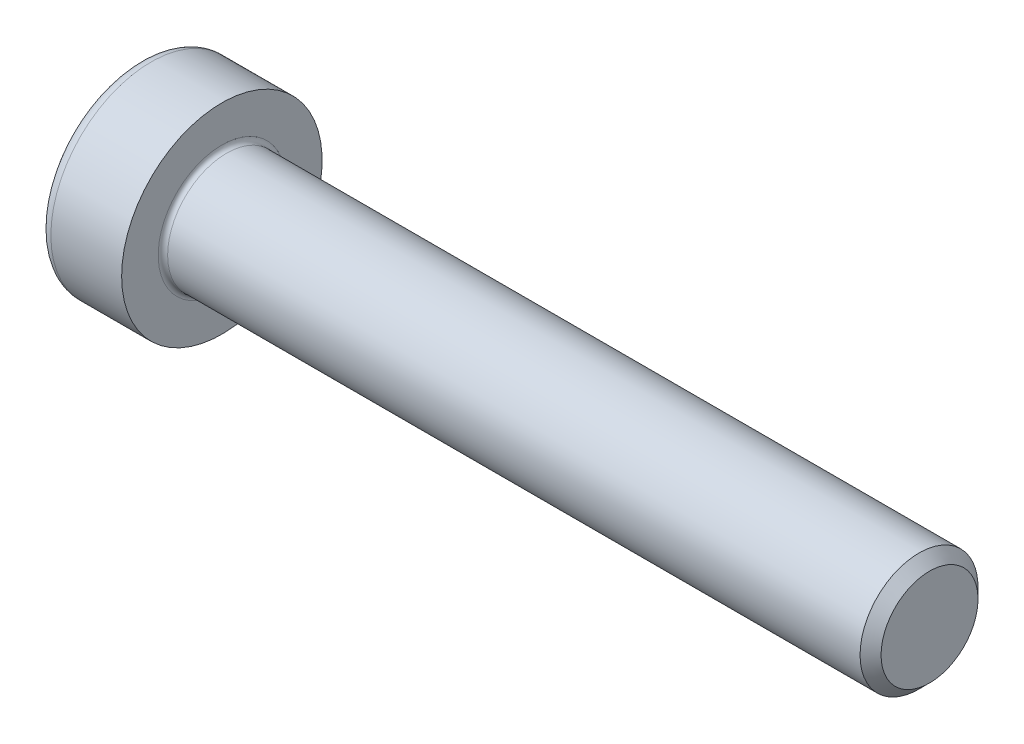
from build123d import *

# Parameters (mm, degrees)
FILLET1_R   = 0.2
FILLET2_R   = 0.5
HEX_2_DEPTH = 2


with BuildPart() as part:
    # BodySke → Base-Revolve (revolve)
    with BuildSketch(Plane.XY, mode=Mode.PRIVATE) as base_revolve_sk:
        Polygon((0, 0), (0, 4.25), (3.5, 4.25), (3.5, 2.5), (33.055, 2.5), (33.5, 2.055), (33.5, 0), align=None)
    revolve(base_revolve_sk.sketch.rotate(Axis((-31.75, 0, 0), (1, 0, 0)), 90), axis=Axis((-31.75, 0, 0), (1, 0, 0)))

    # Fillet1
    fillet1_edges = [part.edges().sort_by_distance(p)[0] for p in [
        (3.5, 0, -2.5),
    ]]
    fillet(fillet1_edges, radius=FILLET1_R)

    # Fillet2
    fillet2_edges = [part.edges().sort_by_distance(p)[0] for p in [
        (0, 0, -4.25),
    ]]
    fillet(fillet2_edges, radius=FILLET2_R)

    # HexSke → Hex 2 (cut)
    with BuildSketch(Plane(origin=(0, 0, 0), x_dir=(0, 0.500000000000001, 0.866025403784438), z_dir=(-1, 0, 0))):
        Polygon((1.154700538, 2), (-1.154700538, 2), (-2.309401077, 0), (-1.154700538, -2), (1.154700538, -2), (2.309401077, 0), align=None)
    extrude(amount=-HEX_2_DEPTH, mode=Mode.SUBTRACT)

    # PilotSke → Hex-PreBroach (revolve, cut)
    with BuildSketch(Plane.XY, mode=Mode.PRIVATE) as hex_prebroach_sk:
        Polygon((0, 2), (2, 2), (2.433012702, 1.25), (4, 1.25), (4.721687836, 0), (0, 0), align=None)
    revolve(hex_prebroach_sk.sketch.rotate(Axis((0, 0, 0), (1, 0, 0)), 90), axis=Axis((0, 0, 0), (1, 0, 0)), mode=Mode.SUBTRACT)


solid = part.part
